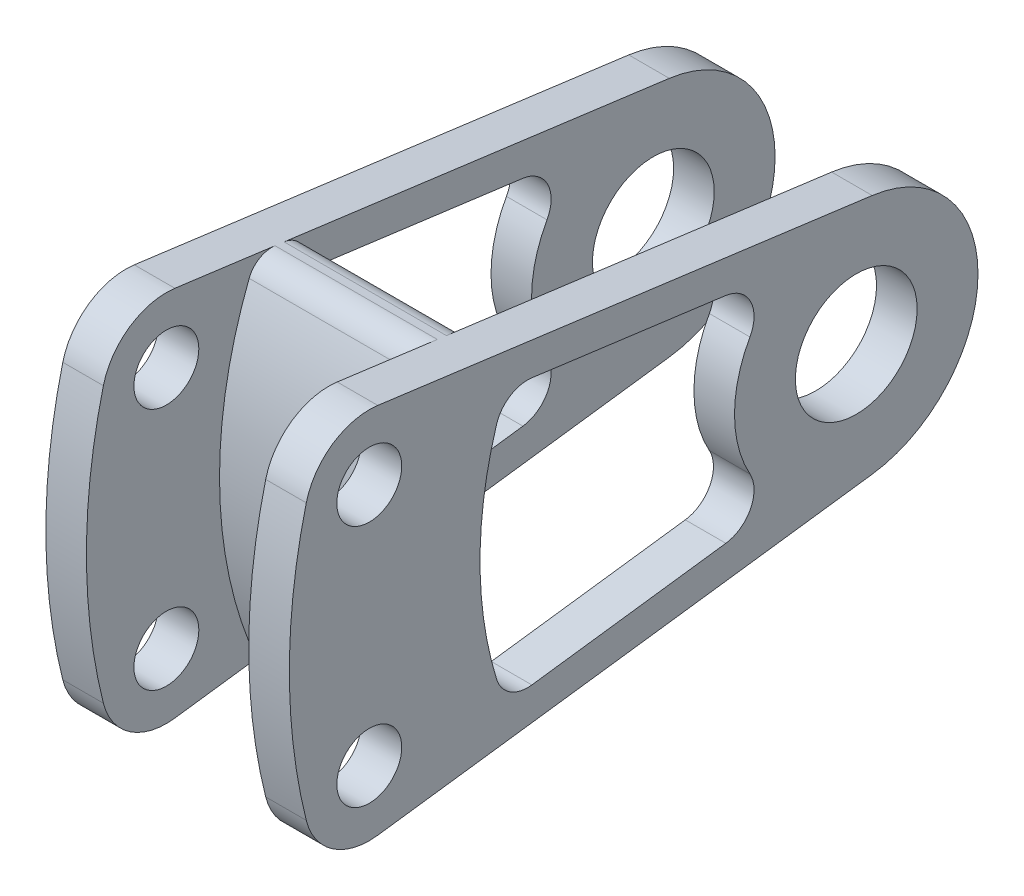
from build123d import *
from build123d.topology import SkipClean

# Parameters (mm, degrees)
SKETCH1_R           = 7.5
SKETCH1_R_2         = 4
BOSS_EXTRUDE2_DEPTH = 15
CUT_EXTRUDE3_DEPTH  = 486.130191019
FILLET1_R           = 4
CUT_EXTRUDE8_DEPTH  = 10
SKETCH16_R          = 46.355085109
CUT_EXTRUDE9_DEPTH  = 10
FILLET6_R           = 3
FILLET7_R           = 3


with BuildPart() as part:
    # Sketch1 → Boss-Extrude2 (new, symmetric)
    with BuildSketch(Plane(origin=(1165, 0, 0), x_dir=(0, 0, -1), z_dir=(1, 0, 0))):
        with BuildLine():
            Line((-401.950614401, -252.930875731), (-341.032402001, -244.870391996))
            ThreePointArc((-341.032402001, -244.870391996), (-328, -230), (-341.032402001, -215.129608004))
            Line((-341.032402001, -215.129608004), (-401.950614401, -207.069124269))
            ThreePointArc((-401.950614401, -207.069124269), (-407.498189204, -208.384390135), (-410.761140001, -213.059715))
            ThreePointArc((-410.761140001, -213.059715), (-412.846584384, -230), (-410.761140001, -246.940285))
            ThreePointArc((-410.761140001, -246.940285), (-407.498189204, -251.615609865), (-401.950614401, -252.930875731))
        make_face()
        with Locations((-343, -230)):
            Circle(SKETCH1_R, mode=Mode.SUBTRACT)
        with Locations((-403, -215)):
            Circle(SKETCH1_R_2, mode=Mode.SUBTRACT)
        with Locations((-403, -245)):
            Circle(SKETCH1_R_2, mode=Mode.SUBTRACT)
    extrude(amount=BOSS_EXTRUDE2_DEPTH, both=True)

    # Sketch3 → Cut-Extrude3 (cut, through all)
    with BuildSketch(Plane.ZY.offset(-1150)):
        with BuildLine():
            Line((386.199035454, -246.8118188), (356.915169615, -242.937080606))
            Line((356.915169615, -242.937080606), (351.667017329, -242.242663543))
            ThreePointArc((351.667017329, -242.242663543), (358, -230), (351.667017329, -217.757336457))
            Line((351.667017329, -217.757336457), (356.915169615, -217.062919394))
            Line((356.915169615, -217.062919394), (386.199035454, -213.1881812))
            ThreePointArc((386.199035454, -213.1881812), (389.355085109, -230), (386.199035454, -246.8118188))
        make_face()
    extrude(amount=-CUT_EXTRUDE3_DEPTH, mode=Mode.SUBTRACT)

    # Fillet1
    fillet1_edges = [part.edges().sort_by_distance(p)[0] for p in [
        (1165, -246.8118188, 386.199035454),
        (1165, -242.242663543, 351.667017329),
        (1165, -217.757336457, 351.667017329),
        (1165, -213.1881812, 386.199035454),
    ]]
    fillet(fillet1_edges, radius=FILLET1_R)

    # Sketch14 → Cut-Extrude8 (cut, symmetric)
    with BuildSketch(Plane(origin=(1165, 0, 0), x_dir=(0, 0, -1), z_dir=(1, 0, 0))):
        with BuildLine():
            Line((-374.476194015, -186.80167911), (-394.628690595, -182.957214607))
            ThreePointArc((-394.628690595, -182.957214607), (-412.839050853, -231.025829466), (-393.224741594, -278.538857444))
            Line((-393.224741594, -278.538857444), (-380.9384348, -267.649978517))
            ThreePointArc((-380.9384348, -267.649978517), (-396.279541596, -225.741342376), (-374.476194015, -186.80167911))
        make_face()
    extrude(amount=CUT_EXTRUDE8_DEPTH, both=True, mode=Mode.SUBTRACT)

    # Sketch16 → Cut-Extrude9 (cut, symmetric)
    with SkipClean():  # the faces are left unmerged after this step: merging them gives an invalid solid
        with BuildSketch(Plane(origin=(1165, 0, 0), x_dir=(0, 0, -1), z_dir=(1, 0, 0))):
            with Locations((-343, -230)):
                Circle(SKETCH16_R)
        extrude(amount=CUT_EXTRUDE9_DEPTH, both=True, mode=Mode.SUBTRACT)

    # Fillet6
    fillet6_edges = [part.edges().sort_by_distance(p)[0] for p in [
        (1165, -208.400223767, 391.890647205),
        (1165, -251.599776233, 391.890647205),
    ]]
    fillet(fillet6_edges, radius=FILLET6_R)

    # Fillet7
    fillet7_edges = [part.edges().sort_by_distance(p)[0] for p in [
        (1165, -250.623789579, 384.514494082),
        (1165, -209.376210421, 384.514494082),
    ]]
    fillet(fillet7_edges, radius=FILLET7_R)


solid = part.part
